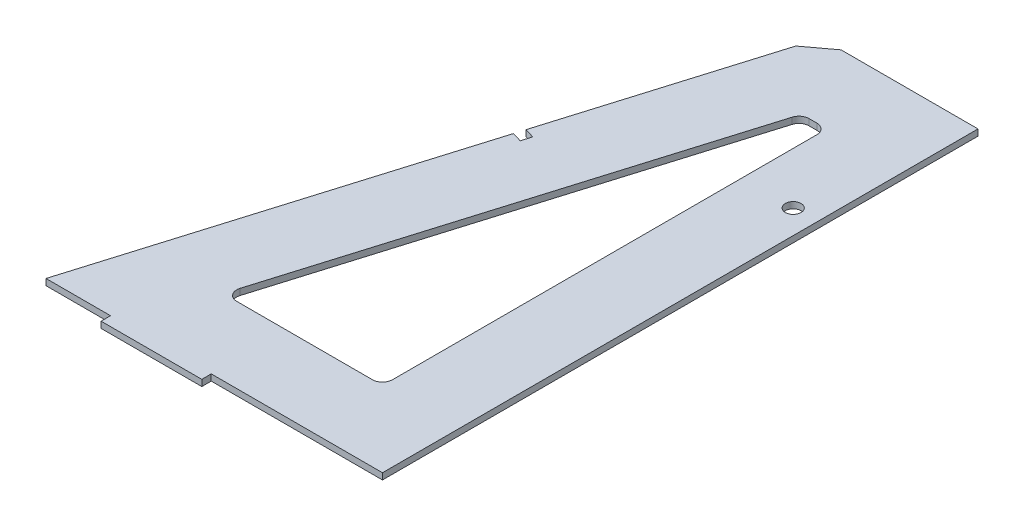
from build123d import *

# Parameters (mm, degrees)
BOSS_EXTRUDE1_DEPTH = 3.175
SKETCH4_W           = 50.8
SKETCH4_H           = 3.175
BOSS_EXTRUDE2_DEPTH = 4.7625
SKETCH6_W           = 300.355
SKETCH6_H           = 3.175
BOSS_EXTRUDE3_DEPTH = 53.8189678
SKETCH7_R           = 3.96875
CUT_EXTRUDE3_DEPTH  = 322.952646539
CUT_EXTRUDE4_DEPTH  = 322.952646539
FILLET1_R           = 5.08
CUT_EXTRUDE5_DEPTH  = 322.952646539


with BuildPart() as part:
    # Sketch2 → Boss-Extrude1 (new body)
    with BuildSketch(Plane(origin=(0, 0, 0), x_dir=(1, 0, 0), z_dir=(0, 1, 0))):
        Polygon((0, 0), (-115.889171037, 0), (-25.4, 300.355), (0, 300.355), align=None)
    extrude(amount=BOSS_EXTRUDE1_DEPTH)

    # Sketch4 → Boss-Extrude2 (add)
    with BuildSketch(Plane.XY):
        with Locations((-57.944585519, 1.5875)):
            Rectangle(SKETCH4_W, SKETCH4_H)
    extrude(amount=BOSS_EXTRUDE2_DEPTH)

    # Sketch6 → Boss-Extrude3 (add)
    with BuildSketch(Plane(origin=(0, 0, 0), x_dir=(0, 0, -1), z_dir=(1, 0, 0))):
        with Locations((150.1775, 1.5875)):
            Rectangle(SKETCH6_W, SKETCH6_H)
    extrude(amount=BOSS_EXTRUDE3_DEPTH)

    # Sketch7 → Cut-Extrude3 (cut, through all)
    with BuildSketch(Plane(origin=(0, 3.175, 0), x_dir=(1, 0, 0), z_dir=(0, 1, 0))):
        with Locations(Location((41.7539678, 219.202, 0), (0, 0, 270))):
            Circle(SKETCH7_R)
        Polygon((-28.330823353, 290.626902834), (-15.24, 300.355), (-25.4, 300.355), align=None)
    extrude(amount=-CUT_EXTRUDE3_DEPTH, mode=Mode.SUBTRACT)

    # Sketch8 → Cut-Extrude4 (cut, through all)
    with BuildSketch(Plane(origin=(0, 3.175, 0), x_dir=(1, 0, 0), z_dir=(0, 1, 0))):
        Polygon((-64.619085916, 38.1), (15.7189678, 38.1), (15.7189678, 262.255), (2.91300156, 262.255), align=None)
    extrude(amount=-CUT_EXTRUDE4_DEPTH, mode=Mode.SUBTRACT)

    # Fillet1
    fillet1_edges = [part.edges().sort_by_distance(p)[0] for p in [
        (-64.619085916, 1.5875, -38.1),
        (2.91300156, 1.5875, -262.255),
        (15.7189678, 1.5875, -262.255),
        (15.7189678, 1.5875, -38.1),
    ]]
    fillet(fillet1_edges, radius=FILLET1_R)

    # Sketch9 → Cut-Extrude5 (cut, through all)
    with BuildSketch(Plane(origin=(0, 3.175, 0), x_dir=(1, 0, 0), z_dir=(0, 1, 0))):
        Polygon((-59.837174403, 186.0498583), (-54.97312582, 184.584446623), (-56.438537497, 179.72039804), (-61.30258608, 181.185809717), align=None)
    extrude(amount=-CUT_EXTRUDE5_DEPTH, mode=Mode.SUBTRACT)


solid = part.part
